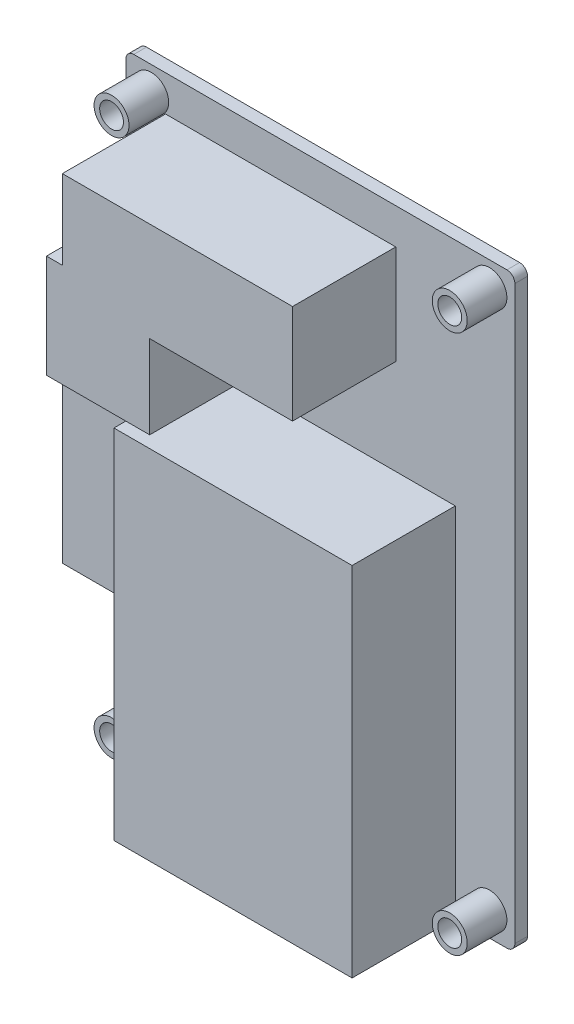
from build123d import *

# Parameters (mm, degrees)
EXTRUDE_1_DEPTH     = 1.6
SKETCH_2_R          = 1.5
CUT_EXTRUDE_1_DEPTH = 45.405067278
EXTRUDE_START       = 5
SKETCH_5_R          = 2.2
SKETCH_5_R_2        = 1.5
EXTRUDE_2_DEPTH     = 5
SKETCH_6_W          = 30
SKETCH_6_H          = 45
EXTRUDE_3_DEPTH     = 13
SKETCH_7_W          = 5
SKETCH_7_H          = 30
EXTRUDE_4_DEPTH     = 3


with BuildPart() as part:
    # 草图1 → 凸台-拉伸1 (new body)
    with BuildSketch(Plane.XY):
        with BuildLine():
            Line((-23.5, -37), (23.5, -37))
            ThreePointArc((23.5, -37), (24.207106781, -36.707106781), (24.5, -36))
            Line((24.5, -36), (24.5, 36))
            ThreePointArc((24.5, 36), (24.207106781, 36.707106781), (23.5, 37))
            Line((23.5, 37), (-23.5, 37))
            ThreePointArc((-23.5, 37), (-24.207106781, 36.707106781), (-24.5, 36))
            Line((-24.5, 36), (-24.5, -36))
            ThreePointArc((-24.5, -36), (-24.207106781, -36.707106781), (-23.5, -37))
        make_face()
    extrude(amount=EXTRUDE_1_DEPTH)

    # 草图2 → 切除-拉伸1 (cut, through all)
    with BuildSketch(Plane.XY.offset(1.6)):
        with Locations((21.3, 33.95)):
            Circle(SKETCH_2_R)
        with Locations((-21.3, 33.95)):
            Circle(SKETCH_2_R)
        with Locations((-21.3, -33.95)):
            Circle(SKETCH_2_R)
        with Locations((21.3, -33.95)):
            Circle(SKETCH_2_R)
    extrude(amount=-CUT_EXTRUDE_1_DEPTH, mode=Mode.SUBTRACT)

    # 草图5 → 凸台-拉伸2 (add)
    # profile 1 of 4: a face of its own
    with BuildSketch(Plane.XY.offset(1.6).offset(EXTRUDE_START)):
        with Locations(Location((-21.3, 33.95, 0), (0, 0, 180))):
            Circle(SKETCH_5_R)
        with Locations((-21.3, 33.95)):
            Circle(SKETCH_5_R_2, mode=Mode.SUBTRACT)
    # profile 2 of 4: a face of its own
    with BuildSketch(Plane.XY.offset(1.6).offset(EXTRUDE_START)):
        with Locations(Location((21.3, -33.95, 0), (0, 0, 180))):
            Circle(SKETCH_5_R)
        with Locations((21.3, -33.95)):
            Circle(SKETCH_5_R_2, mode=Mode.SUBTRACT)
    # profile 3 of 4: a face of its own
    with BuildSketch(Plane.XY.offset(1.6).offset(EXTRUDE_START)):
        with Locations(Location((-21.3, -33.95, 0), (0, 0, 180))):
            Circle(SKETCH_5_R)
        with Locations((-21.3, -33.95)):
            Circle(SKETCH_5_R_2, mode=Mode.SUBTRACT)
    # profile 4 of 4: a face of its own
    with BuildSketch(Plane.XY.offset(1.6).offset(EXTRUDE_START)):
        with Locations(Location((21.3, 33.95, 0), (0, 0, 180))):
            Circle(SKETCH_5_R)
        with Locations((21.3, 33.95)):
            Circle(SKETCH_5_R_2, mode=Mode.SUBTRACT)
    extrude(amount=-EXTRUDE_2_DEPTH)

    # 草图6 → 凸台-拉伸3 (add)
    with BuildSketch(Plane.XY.offset(1.6)):
        Polygon((-8.5, 9.5), (-21.5, 9.5), (-21.5, 22.5), (-19.5, 22.5), (-19.5, 32.5), (9.5, 32.5), (9.5, 20), (-8.5, 20), align=None)
        with Locations((2, -14.5)):
            Rectangle(SKETCH_6_W, SKETCH_6_H)
    extrude(amount=EXTRUDE_3_DEPTH)

    # 草图7 → 凸台-拉伸4 (add)
    with BuildSketch(Plane.XY.offset(1.6)):
        with Locations((-27, -5)):
            Rectangle(SKETCH_7_W, SKETCH_7_H)
        Polygon((-24.5, 10), (-24.5, -20), (-18.5, -20), (-18.5, 9.5), (-21.5, 9.5), (-21.5, 10), align=None)
    extrude(amount=EXTRUDE_4_DEPTH)


solid = part.part
